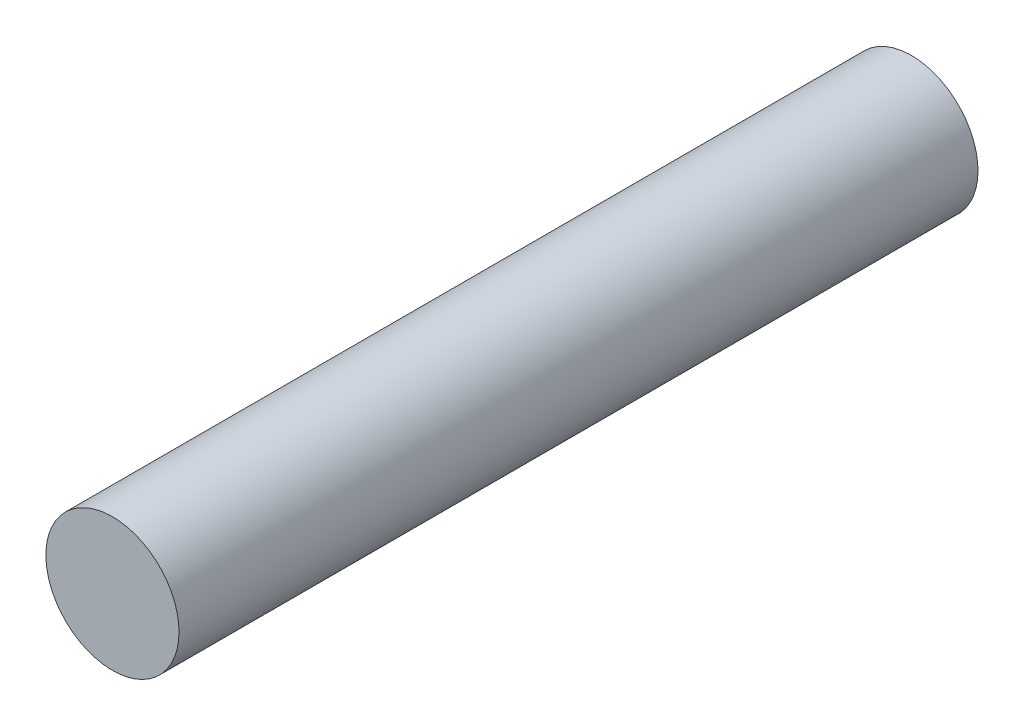
from build123d import *

# Parameters (mm, degrees)
SCHIZZO1_R                   = 2
ESTRUSIONE_ESTRUSIONE1_DEPTH = 24


with BuildPart() as part:
    # Schizzo1 → Estrusione-Estrusione1 (new body)
    with BuildSketch(Plane.XY):
        Circle(SCHIZZO1_R)
    extrude(amount=ESTRUSIONE_ESTRUSIONE1_DEPTH)


solid = part.part
